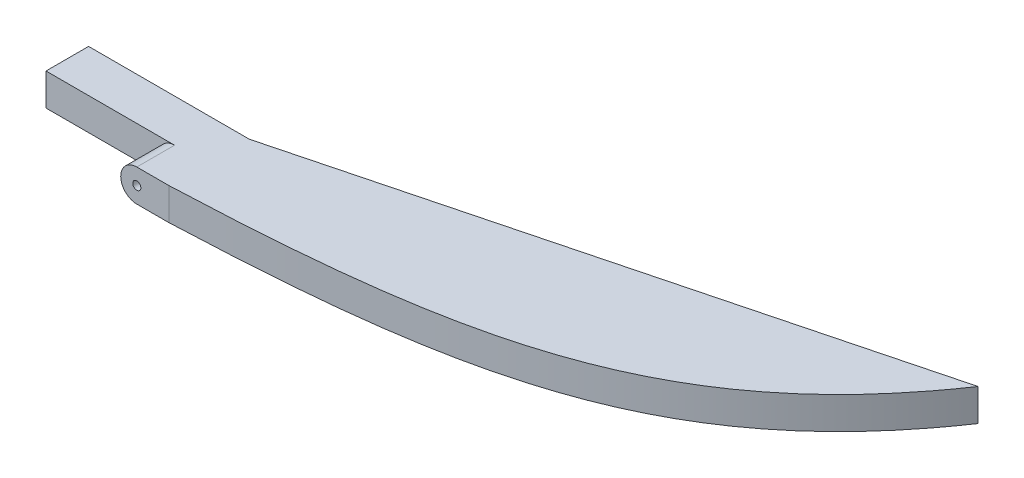
from build123d import *

# Parameters (mm, degrees)
SALIENTE_EXTRUIR1_DEPTH = 5
CROQUIS3_W              = 12.5
CROQUIS3_H              = 5
SALIENTE_EXTRUIR2_DEPTH = 25
CROQUIS6_R              = 0.63
CORTAR_EXTRUIR3_DEPTH   = 1.5
CORTAR_EXTRUIR4_DEPTH   = 5.875


with BuildPart() as part:
    # Croquis2 → Saliente-Extruir1 (new body)
    with BuildSketch(Plane(origin=(0, 0, 0), x_dir=(1, 0, 0), z_dir=(0, 1, 0))):
        with BuildLine():
            Line((0, 0), (0, 12.5))
            Line((0, 12.5), (90, 35.865427318))
            add(Edge.make_bspline(
                [(0, 0), (0.394136999, 0.015797336), (1.194952966, 0.048834045), (2.992448828, 0.125211317), (4.579856068, 0.200911656), (6.612637351, 0.301249971), (8.392251736, 0.398752477), (10.315878033, 0.509903005), (12.159048858, 0.626310038), (14.511736704, 0.785189542), (17.305717547, 0.994336582), (20.114398042, 1.2314722), (22.909905137, 1.499776667), (25.707540494, 1.796493489), (29.430521004, 2.232380684), (34.457318955, 2.928516321), (39.917638309, 3.8880509), (45.326966885, 5.105084916), (49.769918493, 6.319079443), (53.346159155, 7.448006204), (56.870231766, 8.730995456), (60.329622828, 10.180098556), (63.710264837, 11.804910517), (66.997597592, 13.611491814), (70.17732587, 15.601579919), (72.854283587, 17.500893709), (75.067204078, 19.237089159), (76.854732505, 20.752585132), (78.250168573, 22.004629224), (79.619707974, 23.303249768), (80.962355597, 24.647453618), (82.277321506, 26.036087115), (83.403178931, 27.288894321), (84.345387571, 28.382707102), (85.115533062, 29.306902867), (85.722715368, 30.053623655), (86.321025458, 30.807421985), (86.910712224, 31.56828047), (87.491255325, 32.335040025), (88.06431213, 33.109755161), (88.629936117, 33.892108149), (89.099903233, 34.555740193), (89.55695597, 35.215829282), (89.829292977, 35.613909175), (89.943246974, 35.781569234), (90, 35.865427318)],
                knots=[0.074822974, 0.074822974, 0.074822974, 0.074822974, 0.074822974, 0.090398408, 0.105973841, 0.121549274, 0.137124708, 0.152700141, 0.168275574, 0.183851007, 0.199426441, 0.230577307, 0.261728173, 0.277303606, 0.29287904, 0.324029906, 0.386331636, 0.445924571, 0.477075434, 0.508226306, 0.539377159, 0.57052801, 0.601678868, 0.632829681, 0.663980451, 0.695131352, 0.726282194, 0.741857688, 0.757433182, 0.773008671, 0.788584161, 0.804576906, 0.820569651, 0.836562506, 0.844558934, 0.852555362, 0.860551891, 0.86854842, 0.87654495, 0.884541479, 0.89253801, 0.900534541, 0.908531072, 0.912529338, 0.916527603, 0.916527603, 0.916527603, 0.916527603, 0.916527603], degree=4))
        make_face()
    extrude(amount=SALIENTE_EXTRUIR1_DEPTH)

    # Croquis3 → Saliente-Extruir2 (add)
    with BuildSketch(Plane.ZY):
        with Locations((-6.25, 2.5)):
            Rectangle(CROQUIS3_W, CROQUIS3_H)
    extrude(amount=SALIENTE_EXTRUIR2_DEPTH)

    # Croquis6 → Cortar-Extruir3 (cut)
    with BuildSketch(Plane.XY):
        with Locations((-5, 2.5)):
            Circle(CROQUIS6_R)
    extrude(amount=-CORTAR_EXTRUIR3_DEPTH, mode=Mode.SUBTRACT)

    # Croquis5 → Cortar-Extruir4 (cut)
    with BuildSketch(Plane.XY):
        with BuildLine():
            Line((-25, 5), (-25, 0))
            Line((-25, 0), (-4.999999991, 0))
            ThreePointArc((-4.999999991, 0), (-7.5, 2.499999995), (-5, 5))
            Line((-5, 5), (-25, 5))
        make_face()
    extrude(amount=-CORTAR_EXTRUIR4_DEPTH, mode=Mode.SUBTRACT)


solid = part.part
